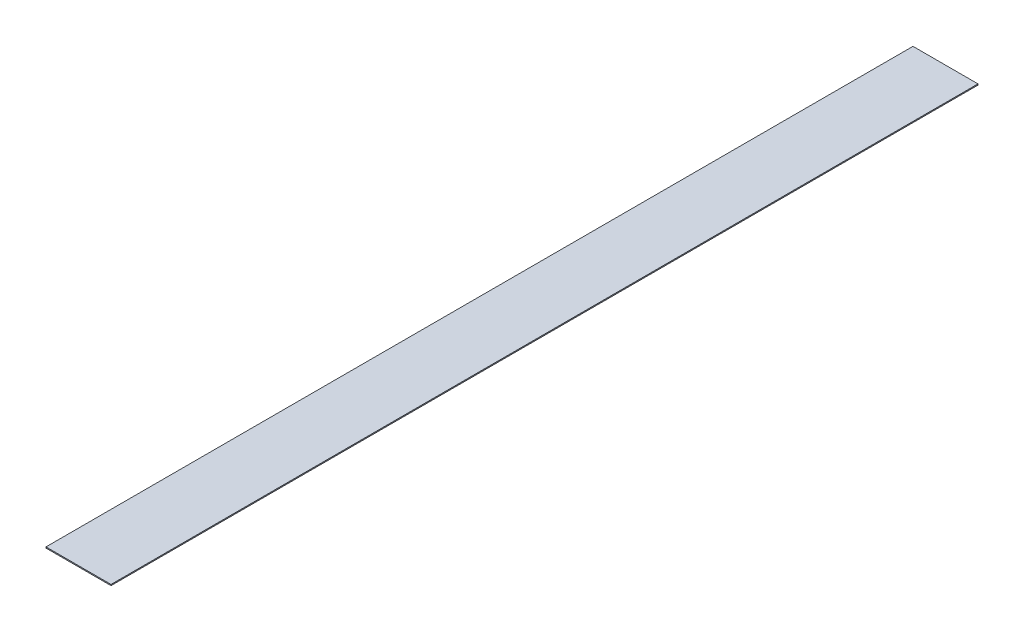
from build123d import *

# Parameters (mm, degrees)
SKETCH1_W           = 6000
SKETCH1_H           = 80000
BOSS_EXTRUDE1_DEPTH = 100


with BuildPart() as part:
    # Sketch1 → Boss-Extrude1 (new body)
    with BuildSketch(Plane(origin=(0, 0, 0), x_dir=(1, 0, 0), z_dir=(0, 1, 0))):
        Rectangle(SKETCH1_W, SKETCH1_H)
    extrude(amount=-BOSS_EXTRUDE1_DEPTH)


solid = part.part
